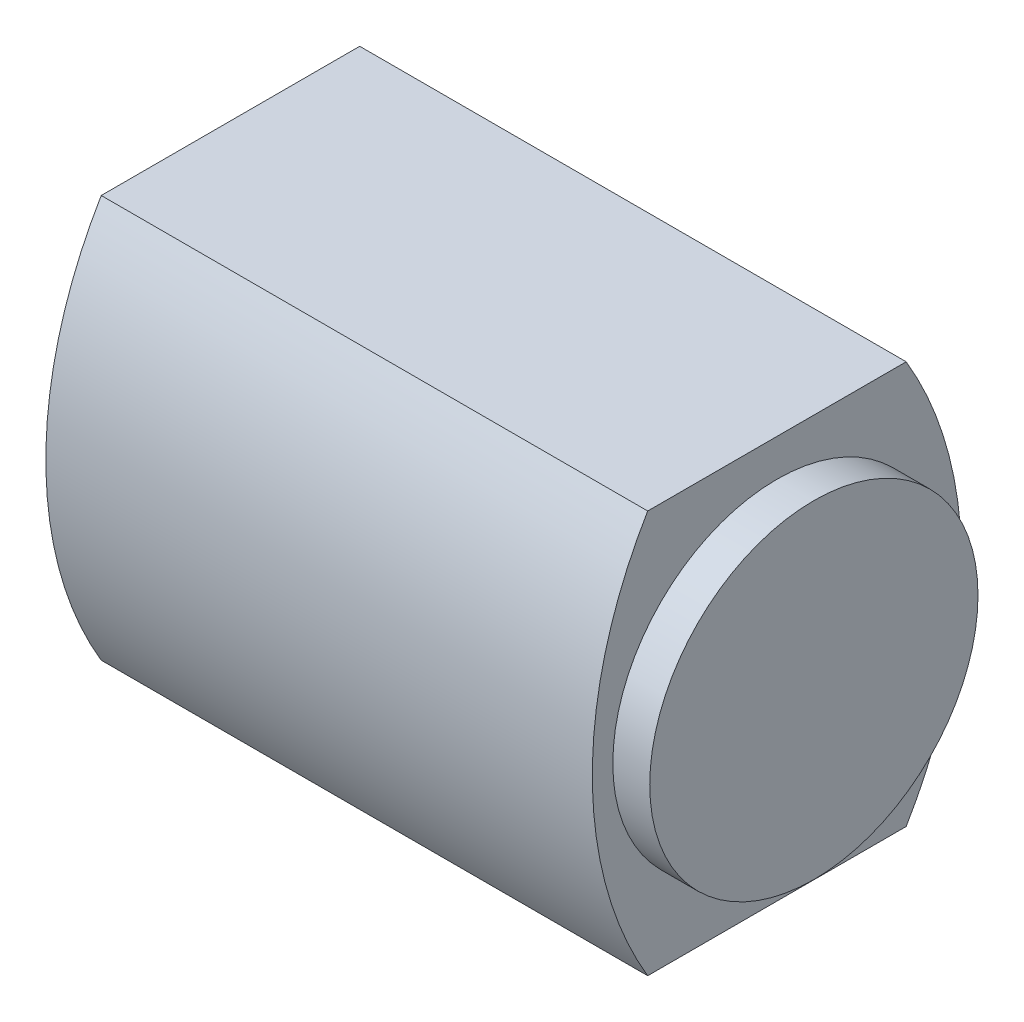
from build123d import *

# Parameters (mm, degrees)
SKETCH6_R           = 44.45
BOSS_EXTRUDE3_DEPTH = 10


with BuildPart() as part:
    # Sketch1 for Loft3 → Loft3 section 0
    with BuildSketch(Plane(origin=(0, 0, 0), x_dir=(0, 0, 1), z_dir=(1, 0, 0))):
        with BuildLine():
            Line((-35, -54.5), (35, -54.5))
            # circular arc as an exact rational Bezier (weights 1, cos(half-angle), 1)
            Bezier((35, -54.5), (67.45879246, 0), (35, 54.5), weights=[1, 0.859165949, 1])
            Line((35, 54.5), (-35, 54.5))
            Bezier((-35, 54.5), (-67.45879246, 0), (-35, -54.5), weights=[1, 0.859165949, 1])
        make_face()
    # Sketch5 for Loft3 → Loft3 section 1
    with BuildSketch(Plane(origin=(148, 148, 0), x_dir=(0, -1, 0), z_dir=(1, 0, 0))):
        with BuildLine():
            Line((93.5, 35), (93.5, -35))
            Bezier((93.5, -35), (148, -67.45879246), (202.5, -35), weights=[1, 0.859165949, 1])
            Line((202.5, -35), (202.5, 35))
            Bezier((202.5, 35), (148, 67.45879246), (93.5, 35), weights=[1, 0.859165949, 1])
        make_face()
    loft()

    # Sketch6 → Boss-Extrude3 (add)
    with BuildSketch(Plane(origin=(148, 0, 0), x_dir=(0, 0, -1), z_dir=(1, 0, 0))):
        Circle(SKETCH6_R)
    extrude(amount=BOSS_EXTRUDE3_DEPTH)


solid = part.part
